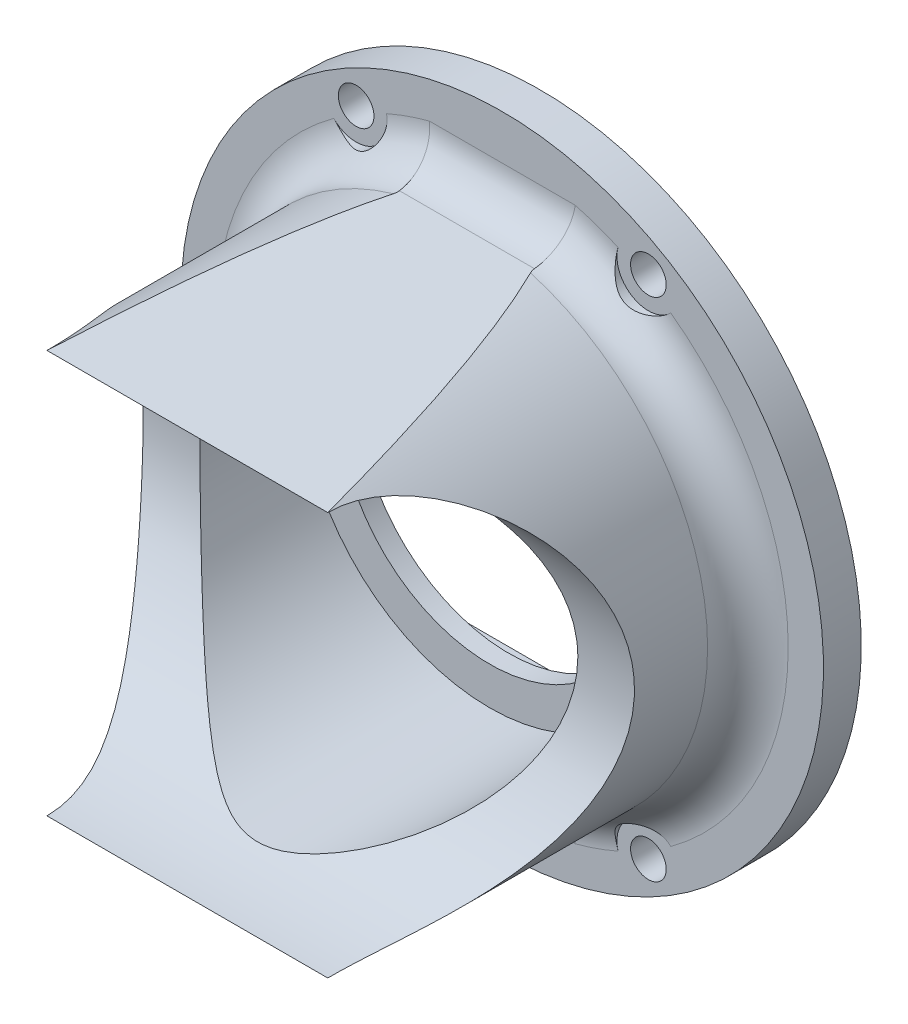
from build123d import *

# Parameters (mm, degrees)
SKETCH1_R                 = 30.95625
BOSS_EXTRUDE1_DEPTH       = 50.8
CUT_EXTRUDE1_DEPTH        = 3.9624
CUT_EXTRUDE2_DEPTH        = 86.860858779
SKETCH4_R                 = 19.05
CUT_EXTRUDE3_DEPTH        = 60.630735383
SKETCH6_R                 = 23.8125
CUT_EXTRUDE4_DEPTH        = 44.45
F_4_40_TAPPED_HOLE1_D     = 2.2606
F_4_40_TAPPED_HOLE1_DEPTH = 7.62
F_4_40_TAPPED_HOLE1_TIP   = 0.679152758
SKETCH10_R                = 40.48125
BOSS_EXTRUDE3_DEPTH       = 4.7625
FILLET1_R                 = 5.08
CIRPATTERN1_COUNT         = 2
CIRPATTERN1_ANGLE         = 60
SKETCH15_R                = 3.9624
CUT_EXTRUDE5_DEPTH        = 5.08


with BuildPart() as part:
    # Sketch1 → Boss-Extrude1 (new body)
    with BuildSketch(Plane.XY):
        Circle(SKETCH1_R)
    extrude(amount=BOSS_EXTRUDE1_DEPTH)

    # Sketch2 → Cut-Extrude1 (cut)
    with BuildSketch(Plane(origin=(0, 0, 0), x_dir=(-1, 0, 0), z_dir=(0, 0, -1))):
        with BuildLine():
            Line((-18.3261, -22.2885), (18.3261, -22.2885))
            ThreePointArc((18.3261, -22.2885), (21.12793991, -21.12793991), (22.2885, -18.3261))
            Line((22.2885, -18.3261), (22.2885, 18.3261))
            ThreePointArc((22.2885, 18.3261), (21.12793991, 21.12793991), (18.3261, 22.2885))
            Line((18.3261, 22.2885), (-18.3261, 22.2885))
            ThreePointArc((-18.3261, 22.2885), (-21.12793991, 21.12793991), (-22.2885, 18.3261))
            Line((-22.2885, 18.3261), (-22.2885, -18.3261))
            ThreePointArc((-22.2885, -18.3261), (-21.12793991, -21.12793991), (-18.3261, -22.2885))
        make_face()
    extrude(amount=-CUT_EXTRUDE1_DEPTH, mode=Mode.SUBTRACT)

    # Sketch3 → Cut-Extrude2 (cut, through all)
    with BuildSketch(Plane(origin=(30.95625, 0, 0), x_dir=(0, 0, -1), z_dir=(1, 0, 0))):
        with BuildLine():
            Line((-44.45, 25.4), (0, 30.95625))
            Line((0, 30.95625), (-50.8, 30.95625))
            Line((-50.8, 30.95625), (-50.8, -30.95625))
            Line((-50.8, -30.95625), (0, -30.95625))
            Line((0, -30.95625), (-44.45, -25.4))
            ThreePointArc((-44.45, -25.4), (-19.05, 0), (-44.45, 25.4))
        make_face()
    extrude(amount=-CUT_EXTRUDE2_DEPTH, mode=Mode.SUBTRACT)

    # Sketch4 → Cut-Extrude3 (cut, through all)
    with BuildSketch(Plane(origin=(0, 0, 3.9624), x_dir=(-1, 0, 0), z_dir=(0, 0, -1))):
        Circle(SKETCH4_R)
    extrude(amount=-CUT_EXTRUDE3_DEPTH, mode=Mode.SUBTRACT)

    # Sketch6 → Cut-Extrude4 (cut)
    with BuildSketch(Plane.XY.offset(50.8)):
        Circle(SKETCH6_R)
    extrude(amount=-CUT_EXTRUDE4_DEPTH, mode=Mode.SUBTRACT)

    # #4-40 Tapped Hole1
    with Locations(Plane(origin=(0, 0, 3.9624), x_dir=(-1, 0, 0), z_dir=(0, 0, -1))):
        with Locations((-18.2626, 18.2626), (18.2626, 18.2626), (18.2626, -18.2626), (-18.2626, -18.2626)):
            Hole(F_4_40_TAPPED_HOLE1_D / 2, depth=F_4_40_TAPPED_HOLE1_DEPTH)
            with Locations((0, 0, -(F_4_40_TAPPED_HOLE1_DEPTH + F_4_40_TAPPED_HOLE1_TIP / 2))):  # 118° drill point
                Cone(0, F_4_40_TAPPED_HOLE1_D / 2, F_4_40_TAPPED_HOLE1_TIP, mode=Mode.SUBTRACT)

    # Sketch10 → Boss-Extrude3 (add)
    with BuildSketch(Plane(origin=(0, 0, 0), x_dir=(-1, 0, 0), z_dir=(0, 0, -1))):
        Circle(SKETCH10_R)
        with BuildLine():
            Line((-17.695463093, 25.4), (17.695463093, 25.4))
            ThreePointArc((17.695463093, 25.4), (30.95625, 0), (17.695463093, -25.4))
            Line((17.695463093, -25.4), (-17.695463093, -25.4))
            ThreePointArc((-17.695463093, -25.4), (-30.95625, 0), (-17.695463093, 25.4))
        make_face(mode=Mode.SUBTRACT)
    extrude(amount=-BOSS_EXTRUDE3_DEPTH)

    # Fillet1
    fillet1_edges = [part.edges().sort_by_distance(p)[0] for p in [
        (30.95625, 0, 4.7625),
        (-30.95625, 0, 4.7625),
        (0, -30.3609375, 4.7625),
        (0, 30.3609375, 4.7625),
    ]]
    fillet(fillet1_edges, radius=FILLET1_R)

    # Sketch13 → #8 Clearance Hole1 (revolve, cut)
    with BuildSketch(Plane(origin=(-18.415, 31.895715621, 4.7625), x_dir=(0, -1, 0), z_dir=(1, 0, 0))):
        Polygon((0, 0), (0, 26.750674586), (2.2479, 25.4), (2.2479, 0), align=None)
    f_8_clearance_hole1 = revolve(axis=Axis((-18.415, 31.895715621, 11.1125), (0, 0, -1)), mode=Mode.SUBTRACT)

    # CirPattern1: #8 Clearance Hole1 ×2 about axis
    cirpattern1_axis = Axis((0, 0, 4.7625), (0, 0, -1))
    for i in range(1, CIRPATTERN1_COUNT):
        add(f_8_clearance_hole1.rotate(cirpattern1_axis, i * CIRPATTERN1_ANGLE / (CIRPATTERN1_COUNT - 1)), mode=Mode.SUBTRACT)

    # Mirror1: #8 Clearance Hole1 across plane
    add(f_8_clearance_hole1.mirror(Plane.ZX), mode=Mode.SUBTRACT)

    # Mirror1 copy 1 sketch → Mirror1 copy 1 (revolve, cut)
    with BuildSketch(Plane(origin=(18.415, -31.895715621, 4.7625), x_dir=(-0.8660254037844399, 0.4999999999999978, 0), z_dir=(0.4999999999999978, 0.8660254037844399, 0))):
        Polygon((0, 0), (0, -26.750674586), (2.2479, -25.4), (2.2479, 0), align=None)
    revolve(axis=Axis((18.415, -31.895715621, 11.1125), (0, 0, 1)), mode=Mode.SUBTRACT)

    # Sketch15 → Cut-Extrude5 (cut)
    with BuildSketch(Plane.XY.offset(9.8425)):
        with Locations((-18.415, 31.895715621)):
            Circle(SKETCH15_R)
        with Locations((18.415, 31.895715621)):
            Circle(SKETCH15_R)
        with Locations((18.415, -31.895715621)):
            Circle(SKETCH15_R)
        with Locations((-18.415, -31.895715621)):
            Circle(SKETCH15_R)
    extrude(amount=-CUT_EXTRUDE5_DEPTH, mode=Mode.SUBTRACT)


solid = part.part
